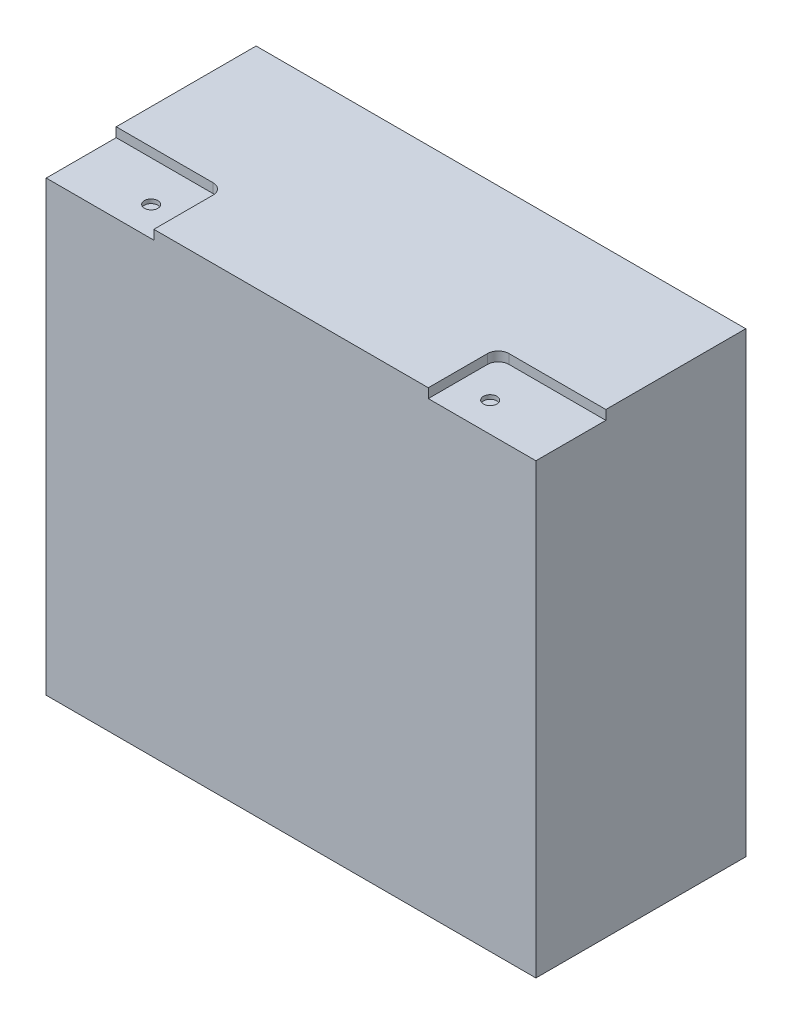
from build123d import *

# Parameters (mm, degrees)
SKETCH1_W           = 182
SKETCH1_H           = 78
BOSS_EXTRUDE1_DEPTH = 170
SKETCH3_R           = 2.5
CUT_EXTRUDE1_DEPTH  = 5
SKETCH4_W           = 40
SKETCH4_H           = 26
CUT_EXTRUDE2_DEPTH  = 3.5
FILLET1_R           = 4


with BuildPart() as part:
    # Sketch1 → Boss-Extrude1 (new body)
    with BuildSketch(Plane(origin=(0, 0, 0), x_dir=(1, 0, 0), z_dir=(0, 1, 0))):
        Rectangle(SKETCH1_W, SKETCH1_H)
    extrude(amount=BOSS_EXTRUDE1_DEPTH)

    # Sketch3 → Cut-Extrude1 (cut)
    with BuildSketch(Plane(origin=(0, 170, 0), x_dir=(1, 0, 0), z_dir=(0, 1, 0))):
        with Locations(Location((63, -28, 0), (0, 0, 270))):
            Circle(SKETCH3_R)
        with Locations(Location((-63, -28, 0), (0, 0, 90))):
            Circle(SKETCH3_R)
    extrude(amount=-CUT_EXTRUDE1_DEPTH, mode=Mode.SUBTRACT)

    # Sketch4 → Cut-Extrude2 (cut)
    with BuildSketch(Plane(origin=(0, 170, 0), x_dir=(1, 0, 0), z_dir=(0, 1, 0))):
        with Locations((-71, -26)):
            Rectangle(SKETCH4_W, SKETCH4_H)
        with Locations((71, -26)):
            Rectangle(SKETCH4_W, SKETCH4_H)
    extrude(amount=-CUT_EXTRUDE2_DEPTH, mode=Mode.SUBTRACT)

    # Fillet1
    fillet1_edges = [part.edges().sort_by_distance(p)[0] for p in [
        (-51, 168.25, 13),
        (51, 168.25, 13),
    ]]
    fillet(fillet1_edges, radius=FILLET1_R)


solid = part.part
